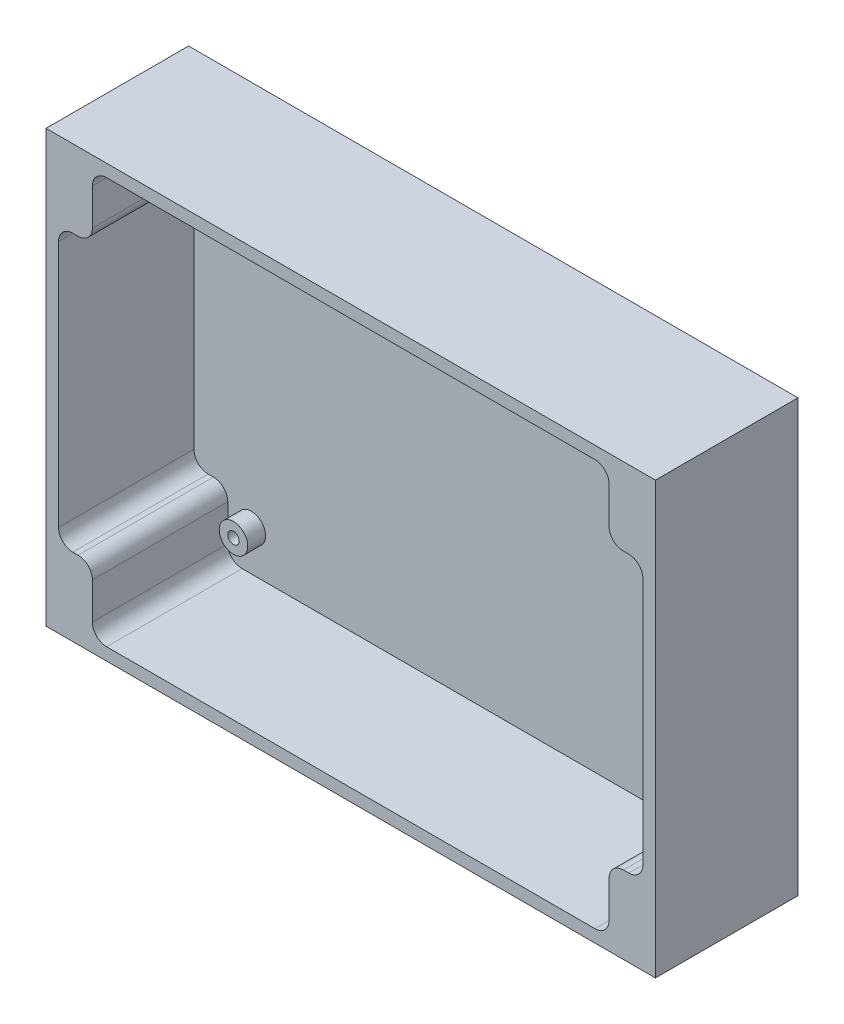
from build123d import *

# Parameters (mm, degrees)
SKETCH_1_W          = 171
SKETCH_1_H          = 121
EXTRUDE_1_DEPTH     = 40
CUT_EXTRUDE_1_DEPTH = 38
SKETCH_3_R          = 4
SKETCH_3_R_2        = 1.6
EXTRUDE_3_DEPTH     = 5


with BuildPart() as part:
    # Эскиз1 → Бобышка-Вытянуть1 (new body)
    with BuildSketch(Plane.XY):
        Rectangle(SKETCH_1_W, SKETCH_1_H)
    extrude(amount=EXTRUDE_1_DEPTH)

    # Эскиз2 → Вырез-Вытянуть1 (cut)
    with BuildSketch(Plane.XY.offset(40)):
        with BuildLine():
            Line((-78, 38.75), (-76.5, 38.75))
            ThreePointArc((-76.5, 38.75), (-73.671572875, 39.921572875), (-72.5, 42.75))
            Line((-72.5, 42.75), (-72.5, 53))
            ThreePointArc((-72.5, 53), (-71.328427125, 55.828427125), (-68.5, 57))
            Line((-68.5, 57), (68.5, 57))
            ThreePointArc((68.5, 57), (71.328427125, 55.828427125), (72.5, 53))
            Line((72.5, 53), (72.5, 42.75))
            ThreePointArc((72.5, 42.75), (73.671572875, 39.921572875), (76.5, 38.75))
            Line((76.5, 38.75), (78, 38.75))
            ThreePointArc((78, 38.75), (80.828427125, 37.578427125), (82, 34.75))
            Line((82, 34.75), (82, -34.75))
            ThreePointArc((82, -34.75), (80.828427125, -37.578427125), (78, -38.75))
            Line((78, -38.75), (76.5, -38.75))
            ThreePointArc((76.5, -38.75), (73.671572875, -39.921572875), (72.5, -42.75))
            Line((72.5, -42.75), (72.5, -53))
            ThreePointArc((72.5, -53), (71.328427125, -55.828427125), (68.5, -57))
            Line((68.5, -57), (-68.5, -57))
            ThreePointArc((-68.5, -57), (-71.328427125, -55.828427125), (-72.5, -53))
            Line((-72.5, -53), (-72.5, -42.75))
            ThreePointArc((-72.5, -42.75), (-73.671572875, -39.921572875), (-76.5, -38.75))
            Line((-76.5, -38.75), (-78, -38.75))
            ThreePointArc((-78, -38.75), (-80.828427125, -37.578427125), (-82, -34.75))
            Line((-82, -34.75), (-82, 34.75))
            ThreePointArc((-82, 34.75), (-80.828427125, 37.578427125), (-78, 38.75))
        make_face()
    extrude(amount=-CUT_EXTRUDE_1_DEPTH, mode=Mode.SUBTRACT)

    # Эскиз3 → Бобышка-Вытянуть3 (add)
    # profile 1 of 6: a face of its own
    with BuildSketch(Plane.XY.offset(2)):
        with Locations(Location((-65.9, 45.75, 0), (0, 0, 180))):
            Circle(SKETCH_3_R)
        with Locations((-65.9, 45.75)):
            Circle(SKETCH_3_R_2, mode=Mode.SUBTRACT)
    # profile 2 of 6: a face of its own
    with BuildSketch(Plane.XY.offset(2)):
        with Locations(Location((65.9, 45.75, 0), (0, 0, 180))):
            Circle(SKETCH_3_R)
        with Locations((65.9, 45.75)):
            Circle(SKETCH_3_R_2, mode=Mode.SUBTRACT)
    # profile 3 of 6: a face of its own
    with BuildSketch(Plane.XY.offset(2)):
        with Locations(Location((65.9, -45.75, 0), (0, 0, 180))):
            Circle(SKETCH_3_R)
        with Locations((65.9, -45.75)):
            Circle(SKETCH_3_R_2, mode=Mode.SUBTRACT)
    # profile 4 of 6: a face of its own
    with BuildSketch(Plane.XY.offset(2)):
        with Locations(Location((-65.9, -45.75, 0), (0, 0, 180))):
            Circle(SKETCH_3_R)
        with Locations((-65.9, -45.75)):
            Circle(SKETCH_3_R_2, mode=Mode.SUBTRACT)
    # profile 5 of 6: a face of its own
    with BuildSketch(Plane.XY.offset(2)):
        with Locations(Location((55.9, -45.75, 0), (0, 0, 180))):
            Circle(SKETCH_3_R)
        with Locations((55.9, -45.75)):
            Circle(SKETCH_3_R_2, mode=Mode.SUBTRACT)
    # profile 6 of 6: a face of its own
    with BuildSketch(Plane.XY.offset(2)):
        with Locations(Location((55.9, 45.75, 0), (0, 0, 180))):
            Circle(SKETCH_3_R)
        with Locations((55.9, 45.75)):
            Circle(SKETCH_3_R_2, mode=Mode.SUBTRACT)
    extrude(amount=EXTRUDE_3_DEPTH)


solid = part.part
